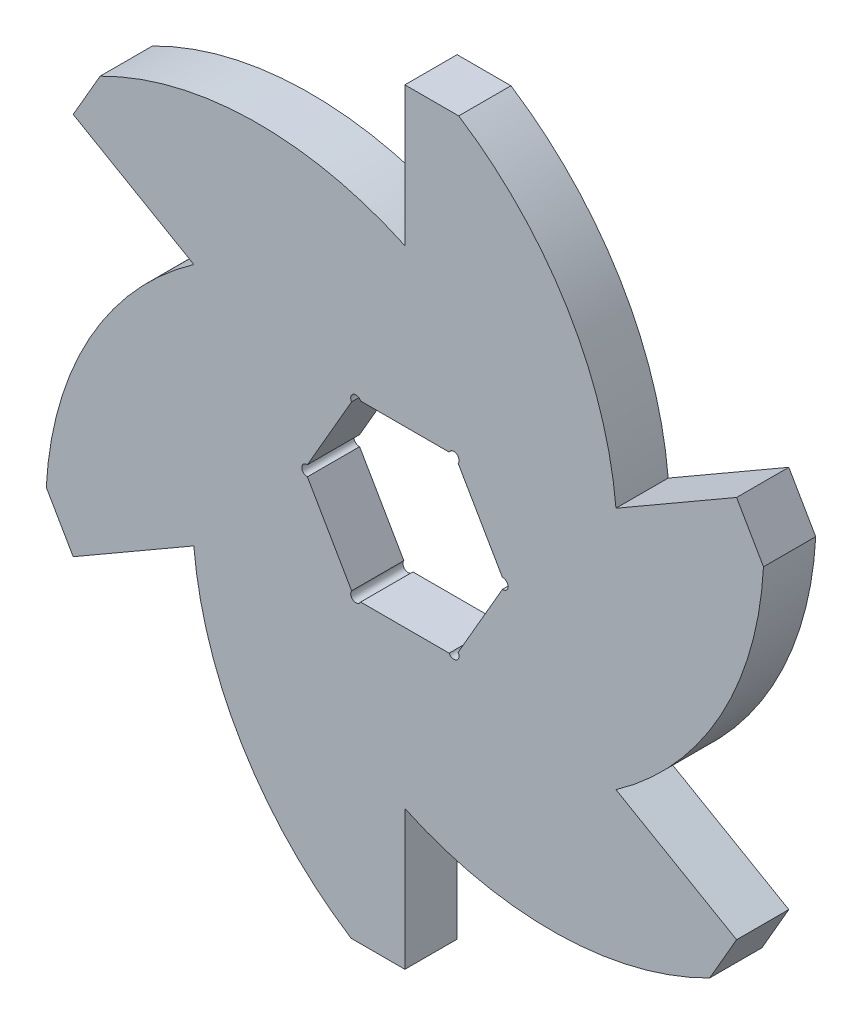
from build123d import *

# Parameters (mm, degrees)
BOSS_EXTRUDE1_DEPTH = 15


with BuildPart() as part:
    # Sketch1 → Boss-Extrude1 (new body)
    with BuildSketch(Plane.XY):
        with BuildLine():
            Line((0, 70), (0, 110))
            Line((0, 110), (15.459491817, 110))
            ThreePointArc((15.459491817, 110), (46.684314733, 77.704911176), (60.621778265, 35))
            Line((60.621778265, 35), (95.262794416, 55))
            Line((95.262794416, 55), (102.992540325, 41.611687357))
            ThreePointArc((102.992540325, 41.611687357), (90.636584443, -1.577346929), (60.621778265, -35))
            Line((60.621778265, -35), (95.262794416, -55))
            Line((95.262794416, -55), (87.533048508, -68.388312643))
            ThreePointArc((87.533048508, -68.388312643), (43.952269711, -79.282258105), (0, -70))
            Line((0, -70), (0, -110))
            Line((0, -110), (-15.459491817, -110))
            ThreePointArc((-15.459491817, -110), (-46.684314733, -77.704911176), (-60.621778265, -35))
            Line((-60.621778265, -35), (-95.262794416, -55))
            Line((-95.262794416, -55), (-102.992540325, -41.611687357))
            ThreePointArc((-102.992540325, -41.611687357), (-90.636584443, 1.577346929), (-60.621778265, 35))
            Line((-60.621778265, 35), (-95.262794416, 55))
            Line((-95.262794416, 55), (-87.533048508, 68.388312643))
            ThreePointArc((-87.533048508, 68.388312643), (-43.952269711, 79.282258105), (0, 70))
        make_face()
        with BuildLine():
            Line((-28.003972595, -1.495696651), (-15.297297594, -23.504303349))
            ThreePointArc((-15.297297594, -23.504303349), (-14.80875673, -25.649519053), (-12.706675001, -25))
            Line((-12.706675001, -25), (12.706675001, -25))
            ThreePointArc((12.706675001, -25), (14.80875673, -25.649519053), (15.297297594, -23.504303349))
            Line((15.297297594, -23.504303349), (28.003972595, -1.495696651))
            ThreePointArc((28.003972595, -1.495696651), (29.617513459, 0), (28.003972595, 1.495696651))
            Line((28.003972595, 1.495696651), (15.297297594, 23.504303349))
            ThreePointArc((15.297297594, 23.504303349), (14.80875673, 25.649519053), (12.706675001, 25))
            Line((12.706675001, 25), (-12.706675001, 25))
            ThreePointArc((-12.706675001, 25), (-14.80875673, 25.649519053), (-15.297297594, 23.504303349))
            Line((-15.297297594, 23.504303349), (-28.003972595, 1.495696651))
            ThreePointArc((-28.003972595, 1.495696651), (-29.617513459, 0), (-28.003972595, -1.495696651))
        make_face(mode=Mode.SUBTRACT)
    extrude(amount=BOSS_EXTRUDE1_DEPTH)


solid = part.part
